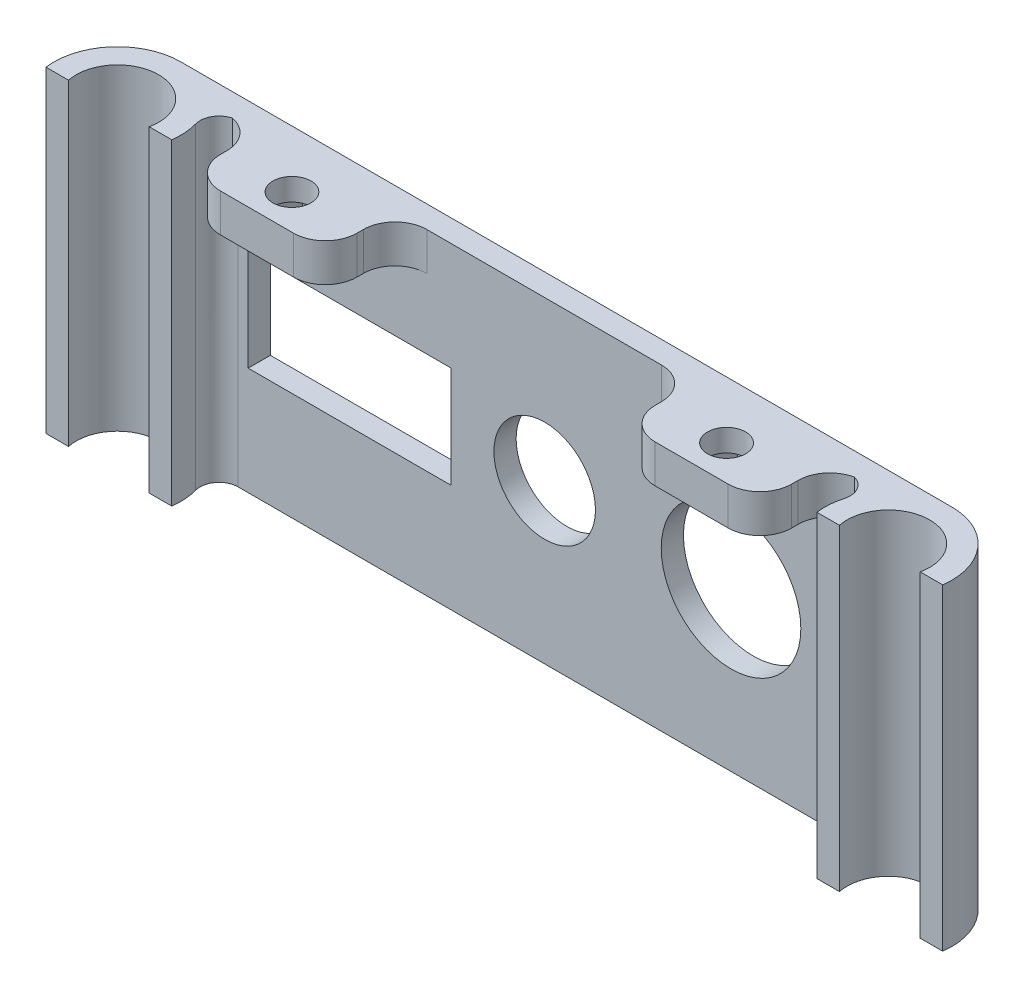
from build123d import *
from build123d.topology import SkipClean

# Parameters (mm, degrees)
BOSS_EXTRUDE2_DEPTH = 50
BOSS_EXTRUDE3_START = -6
BOSS_EXTRUDE3_DEPTH = 6
BOSS_EXTRUDE4_START = 44
BOSS_EXTRUDE4_DEPTH = 44
FILLET1_R           = 5
FILLET2_R           = 3
CUT_EXTRUDE3_DEPTH  = 2.5
SKETCH6_W           = 32
SKETCH6_H           = 8
CUT_EXTRUDE4_DEPTH  = 10


with BuildPart() as part:
    # Sketch1 → Boss-Extrude2 (new body)
    with BuildSketch(Plane(origin=(0, 0, 0), x_dir=(1, 0, 0), z_dir=(0, 1, 0))):
        with BuildLine():
            Line((0, 10), (0, 6.5))
            ThreePointArc((0, 6.5), (4.596194, 4.596194), (6.5, 0))
            ThreePointArc((6.5, 0), (6.464444, -0.678941), (6.358166, -1.350454))
            Line((6.358166, -1.350454), (9.908394, -1.350454))
            ThreePointArc((9.908394, -1.350454), (9.977072, -0.676779), (10, 0))
            ThreePointArc((10, 0), (7.071068, 7.071068), (0, 10))
        make_face()
        with BuildLine():
            ThreePointArc((0, 10), (-4.1833, 9.082951), (-7.599342, 6.5))
            Line((-7.599342, 6.5), (0, 6.5))
            Line((0, 6.5), (0, 10))
        make_face()
        with BuildLine():
            ThreePointArc((-121.5, 10), (-117.3167, 9.082951), (-113.900658, 6.5))
            Line((-113.900658, 6.5), (-7.599342, 6.5))
            ThreePointArc((-7.599342, 6.5), (-4.1833, 9.082951), (0, 10))
            Line((0, 10), (-121.5, 10))
        make_face()
        with BuildLine():
            ThreePointArc((-7.599342, 6.5), (-9.380656, 3.464576), (-10, 0))
            Line((-10, 0), (-6.5, 0))
            ThreePointArc((-6.5, 0), (-4.596194, 4.596194), (0, 6.5))
            Line((0, 6.5), (-7.599342, 6.5))
        make_face()
        with BuildLine():
            Line((-6.5, 0), (-10, 0))
            ThreePointArc((-10, 0), (-9.977072, -0.676779), (-9.908394, -1.350454))
            Line((-9.908394, -1.350454), (-6.358166, -1.350454))
            ThreePointArc((-6.358166, -1.350454), (-6.464444, -0.678941), (-6.5, 0))
        make_face()
        with BuildLine():
            Line((-115, 0), (-111.5, 0))
            ThreePointArc((-111.5, 0), (-112.119344, 3.464576), (-113.900658, 6.5))
            Line((-113.900658, 6.5), (-121.5, 6.5))
            ThreePointArc((-121.5, 6.5), (-116.903806, 4.596194), (-115, 0))
        make_face()
        with BuildLine():
            Line((-121.5, 6.5), (-113.900658, 6.5))
            ThreePointArc((-113.900658, 6.5), (-117.3167, 9.082951), (-121.5, 10))
            ThreePointArc((-121.5, 10), (-129.03341, 6.576301), (-131.408394, -1.350454))
            Line((-131.408394, -1.350454), (-127.858166, -1.350454))
            ThreePointArc((-127.858166, -1.350454), (-126.551136, 4.090969), (-121.5, 6.5))
        make_face()
    extrude(amount=BOSS_EXTRUDE2_DEPTH)

    # Sketch2 → Boss-Extrude3 (add)
    with BuildSketch(Plane(origin=(0, 50, 0), x_dir=(1, 0, 0), z_dir=(0, 1, 0)).offset(BOSS_EXTRUDE3_START)):
        with BuildLine():
            Line((-84.25, -4.5), (-84.25, 6.5))
            Line((-84.25, 6.5), (-95, 6.5))
            Line((-95, 6.5), (-95, 4))
            ThreePointArc((-95, 4), (-92.87868, 3.12132), (-92, 1))
            ThreePointArc((-92, 1), (-92.87868, -1.12132), (-95, -2))
            Line((-95, -2), (-95, -4.5))
            Line((-95, -4.5), (-84.25, -4.5))
        make_face()
        with BuildLine():
            Line((-105.75, -4.5), (-95, -4.5))
            Line((-95, -4.5), (-95, -2))
            ThreePointArc((-95, -2), (-96.732051, -1.44949), (-97.828427, 0))
            Line((-97.828427, 0), (-105.75, 0))
            Line((-105.75, 0), (-105.75, -4.5))
        make_face()
        with BuildLine():
            Line((-95, 4), (-95, 6.5))
            Line((-95, 6.5), (-105.75, 6.5))
            Line((-105.75, 6.5), (-105.75, 0))
            Line((-105.75, 0), (-97.828427, 0))
            ThreePointArc((-97.828427, 0), (-97.44949, 2.732051), (-95, 4))
        make_face()
        with BuildLine():
            Line((-26.5, 6.5), (-37.25, 6.5))
            Line((-37.25, 6.5), (-37.25, -4.5))
            Line((-37.25, -4.5), (-26.5, -4.5))
            Line((-26.5, -4.5), (-26.5, -2))
            ThreePointArc((-26.5, -2), (-29.5, 1), (-26.5, 4))
            Line((-26.5, 4), (-26.5, 6.5))
        make_face()
        with BuildLine():
            Line((-15.75, 6.5), (-26.5, 6.5))
            Line((-26.5, 6.5), (-26.5, 4))
            ThreePointArc((-26.5, 4), (-24.37868, 3.12132), (-23.5, 1))
            ThreePointArc((-23.5, 1), (-23.543204, 0.492694), (-23.671573, 0))
            Line((-23.671573, 0), (-15.75, 0))
            Line((-15.75, 0), (-15.75, 6.5))
        make_face()
        with BuildLine():
            Line((-26.5, -2), (-26.5, -4.5))
            Line((-26.5, -4.5), (-15.75, -4.5))
            Line((-15.75, -4.5), (-15.75, 0))
            Line((-15.75, 0), (-23.671573, 0))
            ThreePointArc((-23.671573, 0), (-24.767949, -1.44949), (-26.5, -2))
        make_face()
        with BuildLine():
            ThreePointArc((-111.5, 0), (-112.119344, 3.464576), (-113.900658, 6.5))
            ThreePointArc((-113.900658, 6.5), (-125.591496, 9.124673), (-131.408394, -1.350454))
            Line((-131.408394, -1.350454), (-127.858166, -1.350454))
            ThreePointArc((-127.858166, -1.350454), (-122.178941, 6.464444), (-115, 0))
            Line((-115, 0), (-111.5, 0))
        make_face()
        with BuildLine():
            ThreePointArc((-111.591606, -1.350454), (-111.522928, -0.676779), (-111.5, 0))
            Line((-111.5, 0), (-115, 0))
            ThreePointArc((-115, 0), (-115.035556, -0.678941), (-115.141834, -1.350454))
            Line((-115.141834, -1.350454), (-111.591606, -1.350454))
        make_face()
    extrude(amount=BOSS_EXTRUDE3_DEPTH)

    # Sketch3 → Boss-Extrude4 (add)
    with SkipClean():  # the faces are left unmerged after this step: merging them gives an invalid solid
        with BuildSketch(Plane.XZ.offset(-44).offset(BOSS_EXTRUDE4_START)):
            with BuildLine():
                Line((-111.591606, 1.350454), (-115.141834, 1.350454))
                ThreePointArc((-115.141834, 1.350454), (-115.035556, 0.678941), (-115, 0))
                Line((-115, 0), (-111.5, 0))
                ThreePointArc((-111.5, 0), (-111.522928, 0.676779), (-111.591606, 1.350454))
            make_face()
        extrude(amount=-BOSS_EXTRUDE4_DEPTH)

    # Fillet1
    fillet1_edges = [part.edges().sort_by_distance(p)[0] for p in [
        (-105.75, 47, 4.5),
        (-105.75, 47, -6.5),
        (-84.25, 47, -6.5),
        (-84.25, 47, 4.5),
        (-15.75, 47, -6.5),
        (-15.75, 47, 4.5),
        (-37.25, 47, 4.5),
        (-37.25, 47, -6.5),
    ]]
    fillet(fillet1_edges, radius=FILLET1_R)

    # Fillet2
    fillet2_edges = [part.edges().sort_by_distance(p)[0] for p in [
        (-7.599342, 25, -6.5),
        (-113.900658, 25, -6.5),
    ]]
    fillet(fillet2_edges, radius=FILLET2_R)

    # Sketch5 → Cut-Extrude3 (cut)
    with SkipClean():  # the faces are left unmerged after this step: merging them gives an invalid solid
        with BuildSketch(Plane.XZ.offset(-44)):
            Polygon((-21.896884, -1), (-24.198442, 2.986415), (-28.801558, 2.986415), (-31.103116, -1), (-28.801558, -4.986415), (-24.198442, -4.986415), align=None)
            Polygon((-90.401179, -1), (-92.70059, 2.982696), (-97.29941, 2.982696), (-99.598821, -1), (-97.29941, -4.982696), (-92.70059, -4.982696), align=None)
        extrude(amount=-CUT_EXTRUDE3_DEPTH, mode=Mode.SUBTRACT)

    # Sketch6 → Cut-Extrude4 (cut)
    with SkipClean():  # the faces are left unmerged after this step: merging them gives an invalid solid
        with BuildSketch(Plane(origin=(0, 0, -10), x_dir=(-1, 0, 0), z_dir=(0, 0, -1))):
            with Locations((91.396524, 21)):
                Rectangle(SKETCH6_W, SKETCH6_H)
            with Locations((91.396524, 29)):
                Rectangle(SKETCH6_W, SKETCH6_H)
            with BuildLine():
                ThreePointArc((68.666891, 25), (60.666891, 33), (52.666891, 25))
                Line((52.666891, 25), (68.666891, 25))
            make_face()
            with BuildLine():
                Line((68.666891, 25), (52.666891, 25))
                ThreePointArc((52.666891, 25), (60.666891, 17), (68.666891, 25))
            make_face()
            with BuildLine():
                ThreePointArc((20.301131, 25), (31.301131, 14), (42.301131, 25))
                Line((42.301131, 25), (20.301131, 25))
            make_face()
            with BuildLine():
                Line((20.301131, 25), (42.301131, 25))
                ThreePointArc((42.301131, 25), (31.301131, 36), (20.301131, 25))
            make_face()
        extrude(amount=-CUT_EXTRUDE4_DEPTH, mode=Mode.SUBTRACT)


solid = part.part
